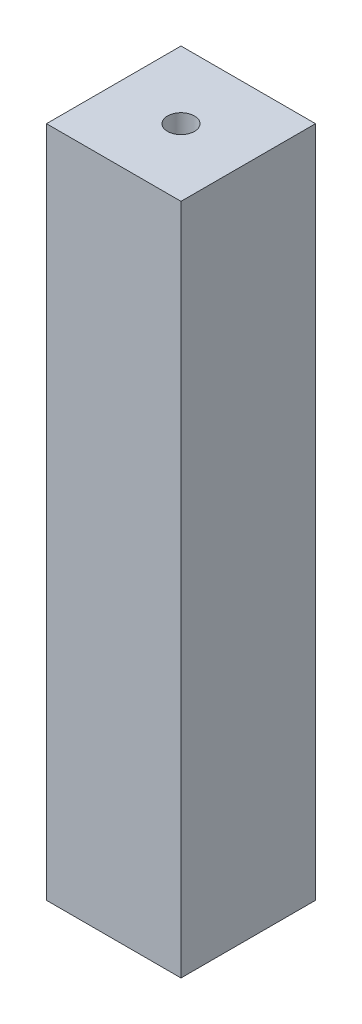
from build123d import *

# Parameters (mm, degrees)
SKETCH1_W           = 20
SKETCH1_H           = 20
BOSS_EXTRUDE1_DEPTH = 100
SKETCH2_R           = 2
CUT_EXTRUDE1_DEPTH  = 100


with BuildPart() as part:
    # Sketch1 → Boss-Extrude1 (new body)
    with BuildSketch(Plane(origin=(0, 0, 0), x_dir=(1, 0, 0), z_dir=(0, 1, 0))):
        with Locations((10, 10)):
            Rectangle(SKETCH1_W, SKETCH1_H)
    extrude(amount=BOSS_EXTRUDE1_DEPTH)

    # Sketch2 → Cut-Extrude1 (cut)
    with BuildSketch(Plane(origin=(0, 100, 0), x_dir=(1, 0, 0), z_dir=(0, 1, 0))):
        with Locations(Location((10, 10, 0), (0, 0, 270))):
            Circle(SKETCH2_R)
    extrude(amount=-CUT_EXTRUDE1_DEPTH, mode=Mode.SUBTRACT)


solid = part.part
